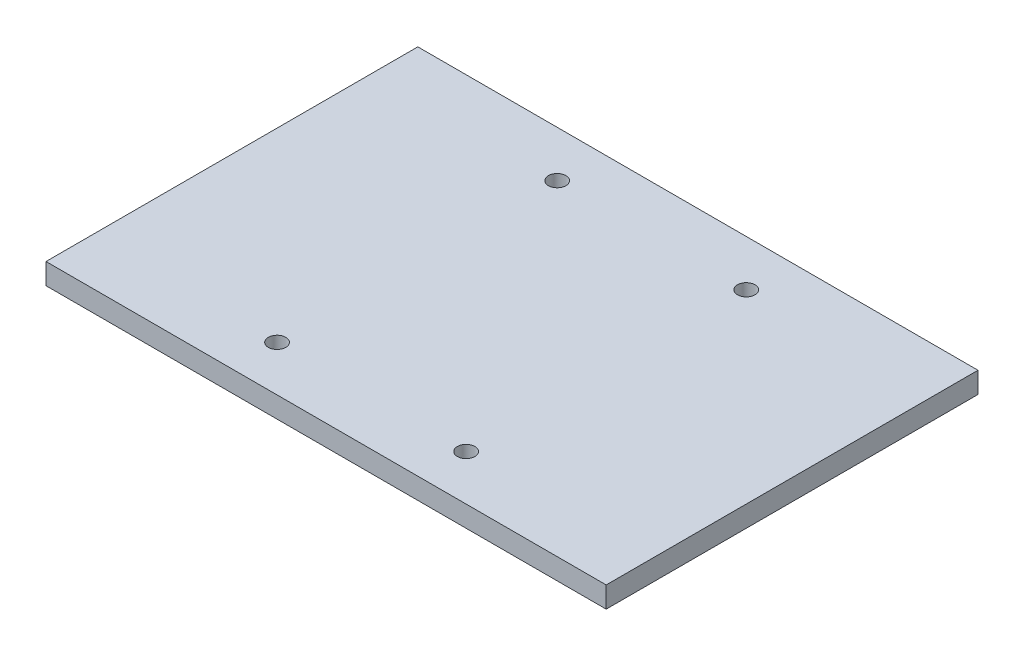
from build123d import *

# Parameters (mm, degrees)
SKIZZE7_W                       = 80
SKIZZE7_H                       = 53.1
AUFSATZ_LINEAR_AUSTRAGEN2_DEPTH = 3
M3_GEWINDEBOHRUNG2_D            = 2.5


with BuildPart() as part:
    # Skizze7 → Aufsatz-Linear austragen2 (new body)
    with BuildSketch(Plane(origin=(0, 0, 0), x_dir=(1, 0, 0), z_dir=(0, 1, 0))):
        with Locations((40, 26.55)):
            Rectangle(SKIZZE7_W, SKIZZE7_H)
    extrude(amount=AUFSATZ_LINEAR_AUSTRAGEN2_DEPTH)

    # M3 Gewindebohrung2 (through all)
    with Locations(Plane(origin=(0, 3, 0), x_dir=(1, 0, 0), z_dir=(0, 1, 0))):
        with Locations((26.5, 6.5), (26.5, 46.5), (53.5, 46.5), (53.5, 6.5)):
            Hole(M3_GEWINDEBOHRUNG2_D / 2)


solid = part.part
